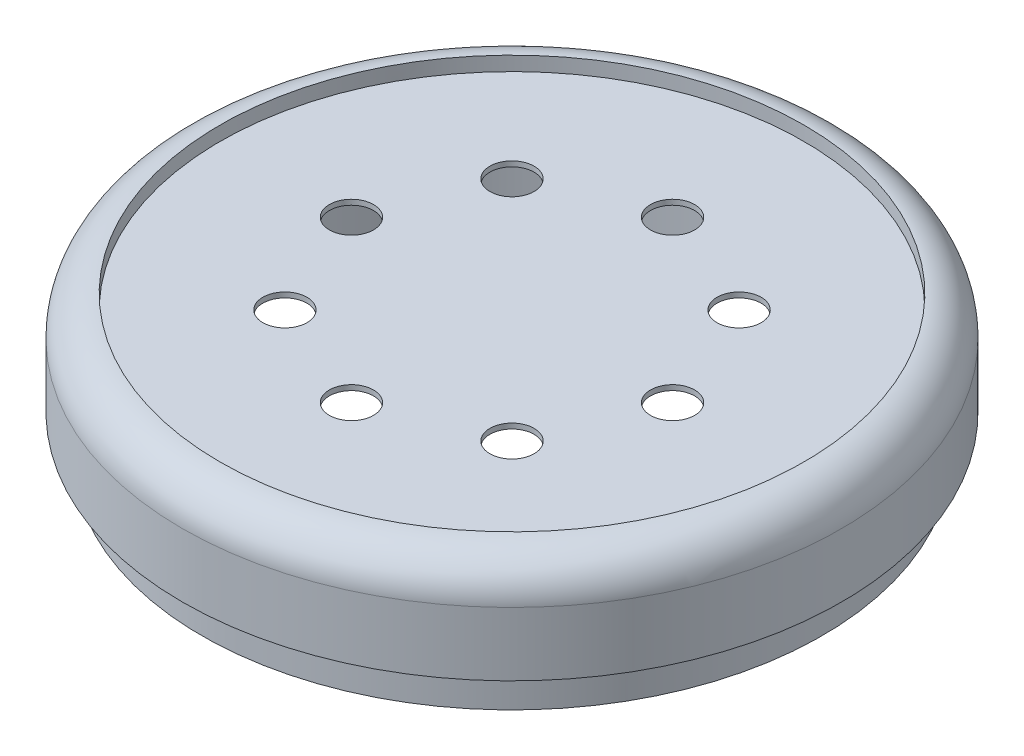
from build123d import *

# Parameters (mm, degrees)
SKETCH1_R           = 25.4
BOSS_EXTRUDE1_DEPTH = 10.9
SKETCH4_OUTSIDE_W   = 67.332
SKETCH4_OUTSIDE_H   = 67.332
SKETCH4_OUTSIDE_R   = 23.9
CUT_EXTRUDE3_DEPTH  = 3
SHELL2_T            = -1.5
SKETCH2_R           = 1.7
CUT_EXTRUDE1_DEPTH  = 38.538380359
FILLET1_R           = 3
SKETCH3_R           = 22.5
CUT_EXTRUDE2_DEPTH  = 1.1


with BuildPart() as part:
    # Sketch1 → Boss-Extrude1 (new body)
    with BuildSketch(Plane(origin=(0, 0, 0), x_dir=(1, 0, 0), z_dir=(0, 1, 0))):
        with Locations(Location((0, 0, 0), (0, 0, 270))):
            Circle(SKETCH1_R)
    extrude(amount=BOSS_EXTRUDE1_DEPTH)

    # Sketch4 outside → Cut-Extrude3 (cut)
    with BuildSketch(Plane.XZ):
        Rectangle(SKETCH4_OUTSIDE_W, SKETCH4_OUTSIDE_H)
        with Locations(Location((0, 0, 0), (0, 0, 270))):
            Circle(SKETCH4_OUTSIDE_R, mode=Mode.SUBTRACT)
    extrude(amount=-CUT_EXTRUDE3_DEPTH, mode=Mode.SUBTRACT)

    # Shell2
    shell2_openings = [part.faces().sort_by_distance(p)[0] for p in [
        (0, 0, 0),
    ]]
    offset(amount=SHELL2_T, openings=shell2_openings, kind=Kind.INTERSECTION)

    # Sketch2 → Cut-Extrude1 (cut, through all)
    with BuildSketch(Plane(origin=(0, 10.9, 0), x_dir=(1, 0, 0), z_dir=(0, 1, 0))):
        with Locations(Location((0, 12.375623311, 0), (0, 0, 270))):
            Circle(SKETCH2_R)
        with Locations(Location((8.750887165, 8.750887165, 0), (0, 0, 270))):
            Circle(SKETCH2_R)
        with Locations(Location((12.375623311, 0, 0), (0, 0, 270))):
            Circle(SKETCH2_R)
        with Locations(Location((8.750887165, -8.750887165, 0), (0, 0, 270))):
            Circle(SKETCH2_R)
        with Locations(Location((0, -12.375623311, 0), (0, 0, 270))):
            Circle(SKETCH2_R)
        with Locations(Location((-8.750887165, -8.750887165, 0), (0, 0, 270))):
            Circle(SKETCH2_R)
        with Locations(Location((-12.375623311, 0, 0), (0, 0, 270))):
            Circle(SKETCH2_R)
        with Locations(Location((-8.750887165, 8.750887165, 0), (0, 0, 270))):
            Circle(SKETCH2_R)
    extrude(amount=-CUT_EXTRUDE1_DEPTH, mode=Mode.SUBTRACT)

    # Fillet1
    fillet1_edges = [part.edges().sort_by_distance(p)[0] for p in [
        (0, 10.9, -25.4),
    ]]
    fillet(fillet1_edges, radius=FILLET1_R)

    # Sketch3 → Cut-Extrude2 (cut)
    with BuildSketch(Plane(origin=(0, 10.9, 0), x_dir=(1, 0, 0), z_dir=(0, 1, 0))):
        with Locations(Location((0, 0, 0), (0, 0, 270))):
            Circle(SKETCH3_R)
    extrude(amount=-CUT_EXTRUDE2_DEPTH, mode=Mode.SUBTRACT)


solid = part.part
